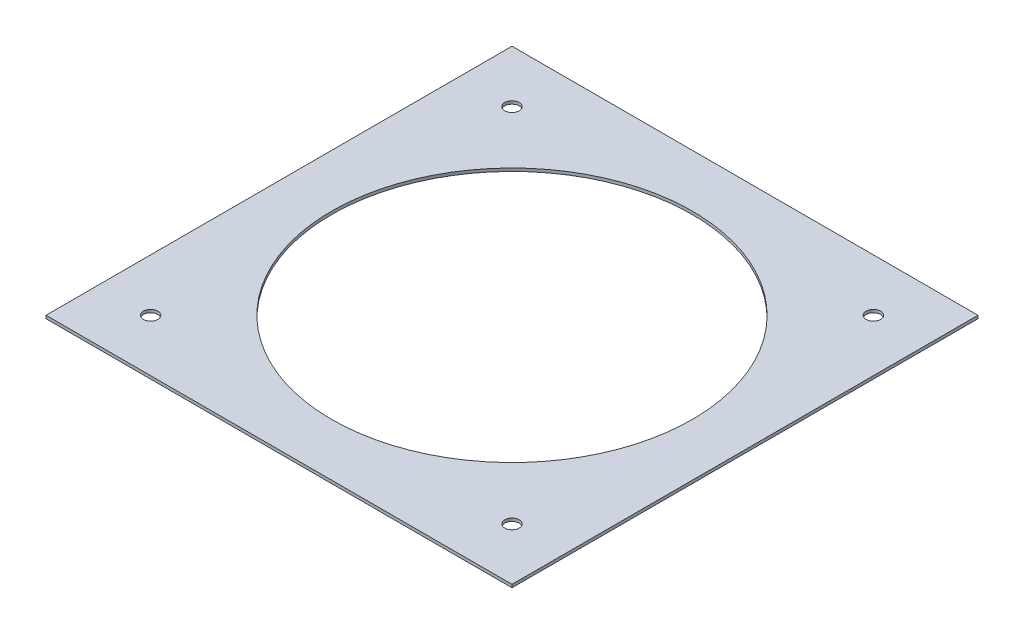
from build123d import *

# Parameters (mm, degrees)
SKETCH2_R           = 2.4
BOSS_EXTRUDE1_DEPTH = 1
SKETCH3_R           = 60
CUT_EXTRUDE1_DEPTH  = 1


with BuildPart() as part:
    # Sketch2 → Boss-Extrude1 (new body)
    with BuildSketch(Plane(origin=(0, 0, 0), x_dir=(1, 0, 0), z_dir=(0, 1, 0))):
        with BuildLine():
            Line((77.497806421, 77.5), (-77.497806421, 77.5))
            ThreePointArc((-77.497806421, 77.5), (-77.498903218, 77.498903218), (-77.5, 77.497806421))
            Line((-77.5, 77.497806421), (-77.5, -77.497806421))
            ThreePointArc((-77.5, -77.497806421), (-77.498903218, -77.498903218), (-77.497806421, -77.5))
            Line((-77.497806421, -77.5), (77.497806421, -77.5))
            ThreePointArc((77.497806421, -77.5), (77.498903218, -77.498903218), (77.5, -77.497806421))
            Line((77.5, -77.497806421), (77.5, 77.497806421))
            ThreePointArc((77.5, 77.497806421), (77.498903218, 77.498903218), (77.497806421, 77.5))
        make_face()
        with Locations(Location((-60.1, -60.1, 0), (0, 0, 270))):
            Circle(SKETCH2_R, mode=Mode.SUBTRACT)
        with Locations(Location((60.1, -60.1, 0), (0, 0, 270))):
            Circle(SKETCH2_R, mode=Mode.SUBTRACT)
        with Locations(Location((-60.1, 60.1, 0), (0, 0, 270))):
            Circle(SKETCH2_R, mode=Mode.SUBTRACT)
        with Locations(Location((60.1, 60.1, 0), (0, 0, 270))):
            Circle(SKETCH2_R, mode=Mode.SUBTRACT)
    extrude(amount=BOSS_EXTRUDE1_DEPTH)

    # Sketch3 → Cut-Extrude1 (cut)
    with BuildSketch(Plane(origin=(0, 1, 0), x_dir=(1, 0, 0), z_dir=(0, 1, 0))):
        with Locations(Location((0, 0, 0), (0, 0, 270))):
            Circle(SKETCH3_R)
    extrude(amount=-CUT_EXTRUDE1_DEPTH, mode=Mode.SUBTRACT)


solid = part.part
